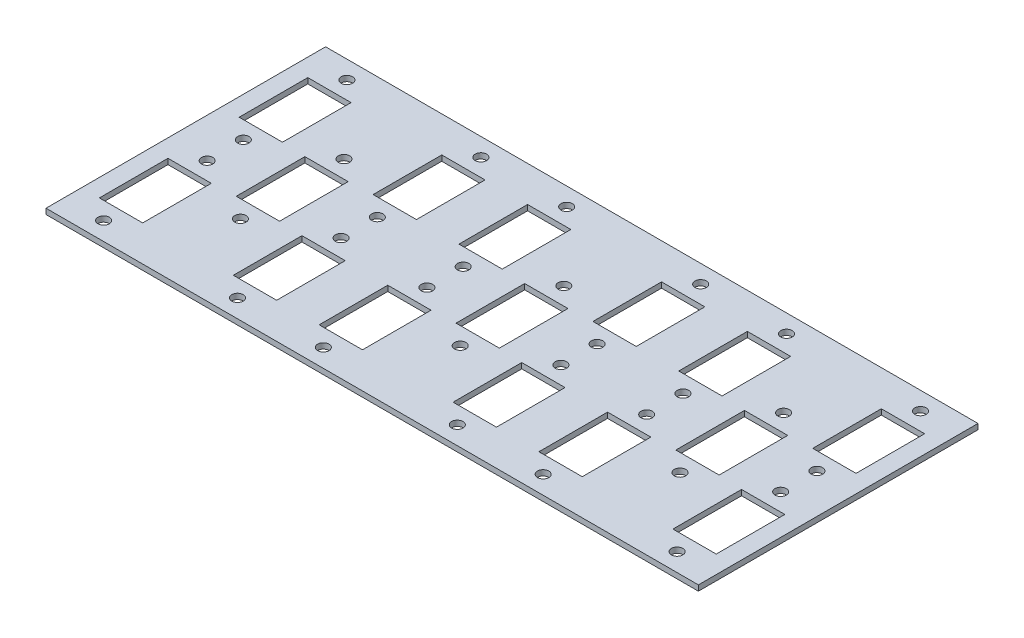
from build123d import *

# Parameters (mm, degrees)
SKETCH4_W                   = 177.8
SKETCH4_H                   = 76.2
BOSS_EXTRUDE3_DEPTH         = 1.5
SOLENOID_PANEL_CUTOUTS_R    = 1.55
SOLENOID_PANEL_CUTOUTS_W    = 11.8
SOLENOID_PANEL_CUTOUTS_H    = 18.7
SOLENOID_PANEL_CUTOUT_DEPTH = 1.5


with BuildPart() as part:
    # Sketch4 → Boss-Extrude3 (new body)
    with BuildSketch(Plane(origin=(0, 0, 0), x_dir=(1, 0, 0), z_dir=(0, 1, 0))):
        with Locations((88.9, 38.1)):
            Rectangle(SKETCH4_W, SKETCH4_H)
    extrude(amount=BOSS_EXTRUDE3_DEPTH)

    # Solenoid Panel Cutouts → Solenoid Panel Cutout (cut)
    with BuildSketch(Plane(origin=(0, 0, 0), x_dir=(1, 0, 0), z_dir=(0, 1, 0))):
        with Locations(Location((10.743745769, 33.162501773, 0), (0, 0, 90))):
            Circle(SOLENOID_PANEL_CUTOUTS_R)
        with Locations(Location((10.743745769, 4.937501773, 0), (0, 0, 90))):
            Circle(SOLENOID_PANEL_CUTOUTS_R)
        with Locations(Location((10.743745769, 71.262501773, 0), (0, 0, 90))):
            Circle(SOLENOID_PANEL_CUTOUTS_R)
        with Locations(Location((10.743745769, 43.037501773, 0), (0, 0, 90))):
            Circle(SOLENOID_PANEL_CUTOUTS_R)
        with Locations(Location((47.256245769, 71.262501773, 0), (0, 0, 90))):
            Circle(SOLENOID_PANEL_CUTOUTS_R)
        with Locations(Location((47.256245769, 43.037501773, 0), (0, 0, 90))):
            Circle(SOLENOID_PANEL_CUTOUTS_R)
        with Locations(Location((70.643745769, 71.262501773, 0), (0, 0, 90))):
            Circle(SOLENOID_PANEL_CUTOUTS_R)
        with Locations(Location((70.643745769, 43.037501773, 0), (0, 0, 90))):
            Circle(SOLENOID_PANEL_CUTOUTS_R)
        with Locations(Location((107.156245769, 71.262501773, 0), (0, 0, 90))):
            Circle(SOLENOID_PANEL_CUTOUTS_R)
        with Locations(Location((107.156245769, 43.037501773, 0), (0, 0, 90))):
            Circle(SOLENOID_PANEL_CUTOUTS_R)
        with Locations(Location((130.543745769, 71.262501773, 0), (0, 0, 90))):
            Circle(SOLENOID_PANEL_CUTOUTS_R)
        with Locations(Location((130.543745769, 43.037501773, 0), (0, 0, 90))):
            Circle(SOLENOID_PANEL_CUTOUTS_R)
        with Locations(Location((167.056245769, 71.262501773, 0), (0, 0, 90))):
            Circle(SOLENOID_PANEL_CUTOUTS_R)
        with Locations(Location((167.056245769, 43.037501773, 0), (0, 0, 90))):
            Circle(SOLENOID_PANEL_CUTOUTS_R)
        with Locations(Location((28.999995769, 52.212501773, 0), (0, 0, 90))):
            Circle(SOLENOID_PANEL_CUTOUTS_R)
        with Locations(Location((28.999995769, 23.987501773, 0), (0, 0, 90))):
            Circle(SOLENOID_PANEL_CUTOUTS_R)
        with Locations(Location((47.256245769, 33.162501773, 0), (0, 0, 90))):
            Circle(SOLENOID_PANEL_CUTOUTS_R)
        with Locations(Location((47.256245769, 4.937501773, 0), (0, 0, 90))):
            Circle(SOLENOID_PANEL_CUTOUTS_R)
        with Locations(Location((70.643745769, 33.162501773, 0), (0, 0, 90))):
            Circle(SOLENOID_PANEL_CUTOUTS_R)
        with Locations(Location((70.643745769, 4.937501773, 0), (0, 0, 90))):
            Circle(SOLENOID_PANEL_CUTOUTS_R)
        with Locations(Location((88.899995769, 52.212501773, 0), (0, 0, 90))):
            Circle(SOLENOID_PANEL_CUTOUTS_R)
        with Locations(Location((88.899995769, 23.987501773, 0), (0, 0, 90))):
            Circle(SOLENOID_PANEL_CUTOUTS_R)
        with Locations(Location((107.156245769, 33.162501773, 0), (0, 0, 90))):
            Circle(SOLENOID_PANEL_CUTOUTS_R)
        with Locations(Location((107.156245769, 4.937501773, 0), (0, 0, 90))):
            Circle(SOLENOID_PANEL_CUTOUTS_R)
        with Locations(Location((130.543745769, 33.162501773, 0), (0, 0, 90))):
            Circle(SOLENOID_PANEL_CUTOUTS_R)
        with Locations(Location((130.543745769, 4.937501773, 0), (0, 0, 90))):
            Circle(SOLENOID_PANEL_CUTOUTS_R)
        with Locations(Location((148.799995769, 52.212501773, 0), (0, 0, 90))):
            Circle(SOLENOID_PANEL_CUTOUTS_R)
        with Locations(Location((148.799995769, 23.987501773, 0), (0, 0, 90))):
            Circle(SOLENOID_PANEL_CUTOUTS_R)
        with Locations(Location((167.056245769, 33.162501773, 0), (0, 0, 90))):
            Circle(SOLENOID_PANEL_CUTOUTS_R)
        with Locations(Location((167.056245769, 4.937501773, 0), (0, 0, 90))):
            Circle(SOLENOID_PANEL_CUTOUTS_R)
        with Locations((10.743745769, 19.050001773)):
            Rectangle(SOLENOID_PANEL_CUTOUTS_W, SOLENOID_PANEL_CUTOUTS_H)
        with Locations((10.743745769, 57.150001773)):
            Rectangle(SOLENOID_PANEL_CUTOUTS_W, SOLENOID_PANEL_CUTOUTS_H)
        with Locations((47.256245769, 57.150001773)):
            Rectangle(SOLENOID_PANEL_CUTOUTS_W, SOLENOID_PANEL_CUTOUTS_H)
        with Locations((70.643745769, 57.150001773)):
            Rectangle(SOLENOID_PANEL_CUTOUTS_W, SOLENOID_PANEL_CUTOUTS_H)
        with Locations((107.156245769, 57.150001773)):
            Rectangle(SOLENOID_PANEL_CUTOUTS_W, SOLENOID_PANEL_CUTOUTS_H)
        with Locations((130.543745769, 57.150001773)):
            Rectangle(SOLENOID_PANEL_CUTOUTS_W, SOLENOID_PANEL_CUTOUTS_H)
        with Locations((167.056245769, 57.150001773)):
            Rectangle(SOLENOID_PANEL_CUTOUTS_W, SOLENOID_PANEL_CUTOUTS_H)
        with Locations((28.999995769, 38.100001773)):
            Rectangle(SOLENOID_PANEL_CUTOUTS_W, SOLENOID_PANEL_CUTOUTS_H)
        with Locations((47.256245769, 19.050001773)):
            Rectangle(SOLENOID_PANEL_CUTOUTS_W, SOLENOID_PANEL_CUTOUTS_H)
        with Locations((70.643745769, 19.050001773)):
            Rectangle(SOLENOID_PANEL_CUTOUTS_W, SOLENOID_PANEL_CUTOUTS_H)
        with Locations((88.899995769, 38.100001773)):
            Rectangle(SOLENOID_PANEL_CUTOUTS_W, SOLENOID_PANEL_CUTOUTS_H)
        with Locations((107.156245769, 19.050001773)):
            Rectangle(SOLENOID_PANEL_CUTOUTS_W, SOLENOID_PANEL_CUTOUTS_H)
        with Locations((130.543745769, 19.050001773)):
            Rectangle(SOLENOID_PANEL_CUTOUTS_W, SOLENOID_PANEL_CUTOUTS_H)
        with Locations((148.799995769, 38.100001773)):
            Rectangle(SOLENOID_PANEL_CUTOUTS_W, SOLENOID_PANEL_CUTOUTS_H)
        with Locations((167.056245769, 19.050001773)):
            Rectangle(SOLENOID_PANEL_CUTOUTS_W, SOLENOID_PANEL_CUTOUTS_H)
    extrude(amount=SOLENOID_PANEL_CUTOUT_DEPTH, mode=Mode.SUBTRACT)


solid = part.part
